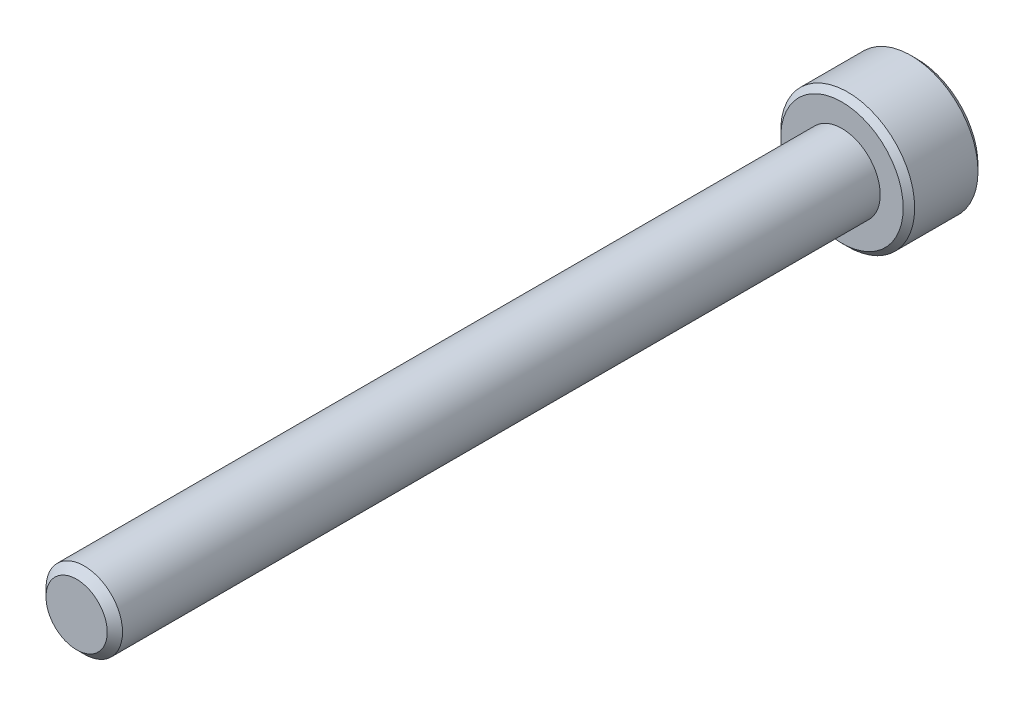
from build123d import *

# Parameters (mm, degrees)
SKETCH_1_R          = 3.5
EXTRUDE_1_DEPTH     = 3.91
SKETCH_2_R          = 2
EXTRUDE_2_DEPTH     = 40
CUT_EXTRUDE_1_DEPTH = 2
CHAMFER_1_SIZE      = 0.4
CHAMFER_2_SIZE      = 0.3


with BuildPart() as part:
    # 草图1 → 凸台-拉伸1 (new body)
    with BuildSketch(Plane.XY):
        Circle(SKETCH_1_R)
    extrude(amount=EXTRUDE_1_DEPTH)

    # 草图2 → 凸台-拉伸2 (add)
    with BuildSketch(Plane.XY.offset(3.91)):
        Circle(SKETCH_2_R)
    extrude(amount=EXTRUDE_2_DEPTH)

    # 草图3 → 切除-拉伸1 (cut)
    with BuildSketch(Plane(origin=(0, 0, 0), x_dir=(-1, 0, 0), z_dir=(0, 0, -1))):
        Polygon((0, 1.760918321), (-1.525, 0.880459161), (-1.525, -0.880459161), (0, -1.760918321), (1.525, -0.880459161), (1.525, 0.880459161), align=None)
    extrude(amount=-CUT_EXTRUDE_1_DEPTH, mode=Mode.SUBTRACT)

    # 倒角1
    chamfer_1_edges = [part.edges().sort_by_distance(p)[0] for p in [
        (-2, 0, 43.91),
    ]]
    chamfer(chamfer_1_edges, length=CHAMFER_1_SIZE)

    # 倒角2
    chamfer_2_edges = [part.edges().sort_by_distance(p)[0] for p in [
        (-3.5, 0, 0),
        (-3.5, 0, 3.91),
    ]]
    chamfer(chamfer_2_edges, length=CHAMFER_2_SIZE)


solid = part.part
